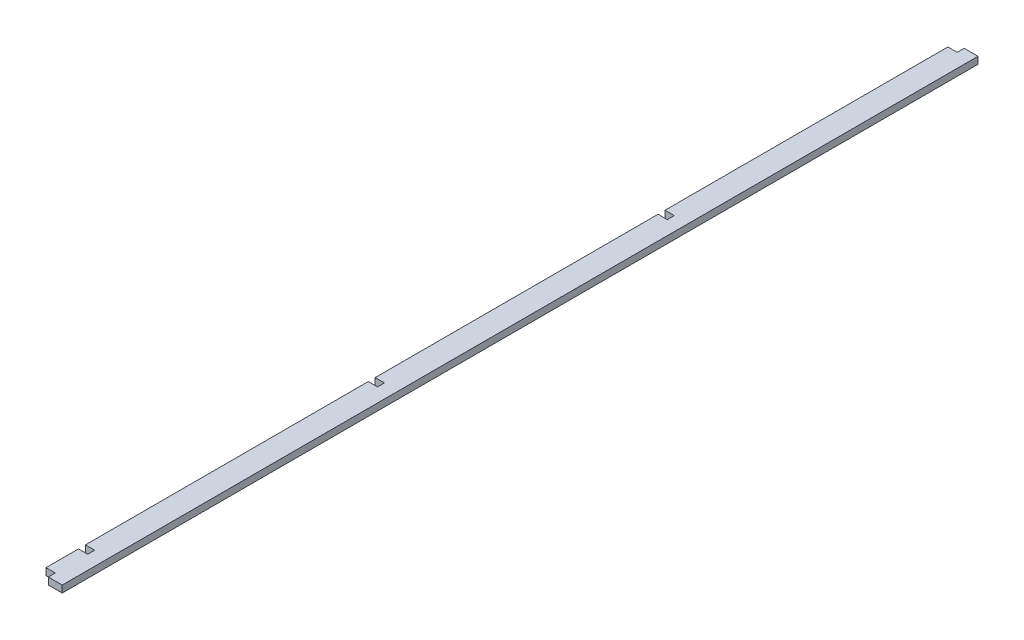
from build123d import *

# Parameters (mm, degrees)
SKETCH_1_W          = 10
SKETCH_1_H          = 3
EXTRUDE_1_DEPTH     = 395
SKETCH_2_W          = 4
SKETCH_2_H          = 3
CUT_EXTRUDE_1_DEPTH = 1168.363523234


with BuildPart() as part:
    # 草图1 → 凸台-拉伸1 (new body)
    with BuildSketch(Plane.XY.offset(1160.01)):
        with Locations((125.787596038, -4.889694097)):
            Rectangle(SKETCH_1_W, SKETCH_1_H)
    extrude(amount=-EXTRUDE_1_DEPTH)

    # 草图2 → 切除-拉伸1 (cut, through all)
    with BuildSketch(Plane(origin=(0, -3.389694097, 0), x_dir=(1, 0, 0), z_dir=(0, 1, 0))):
        with Locations((122.787596038, -891.51)):
            Rectangle(SKETCH_2_W, SKETCH_2_H)
        with Locations((122.787596038, -766.51)):
            Rectangle(SKETCH_2_W, SKETCH_2_H)
        with Locations((122.787596038, -1016.51)):
            Rectangle(SKETCH_2_W, SKETCH_2_H)
        with Locations((122.787596038, -1141.51)):
            Rectangle(SKETCH_2_W, SKETCH_2_H)
        with Locations((122.787596038, -1158.51)):
            Rectangle(SKETCH_2_W, SKETCH_2_H)
    extrude(amount=-CUT_EXTRUDE_1_DEPTH, mode=Mode.SUBTRACT)


solid = part.part
